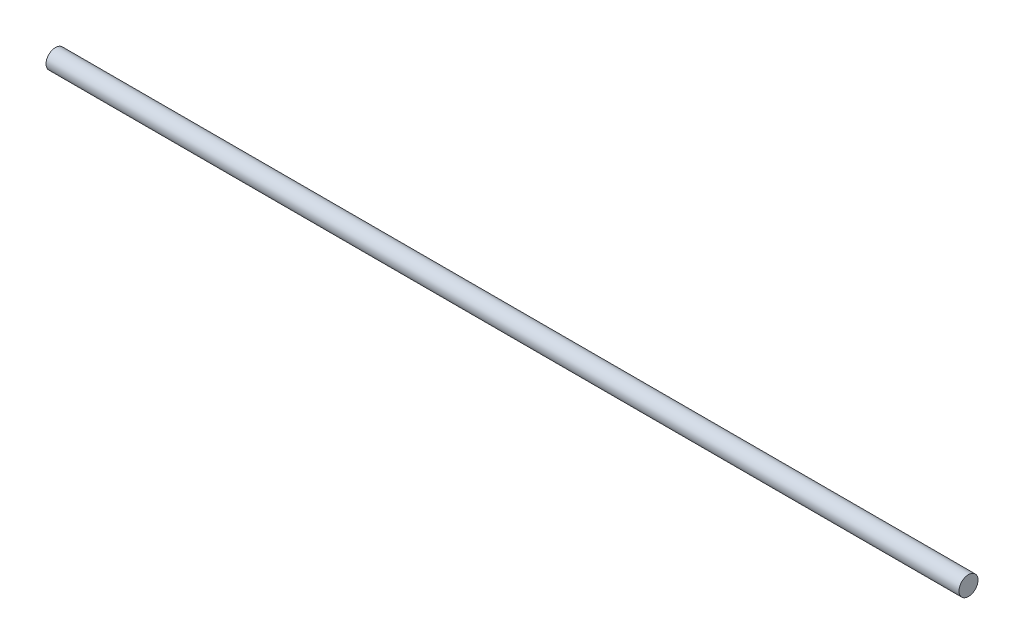
from build123d import *

# Parameters (mm, degrees)
SKETCH1_R           = 3.175
BOSS_EXTRUDE1_DEPTH = 304.8


with BuildPart() as part:
    # Sketch1 → Boss-Extrude1 (new body)
    with BuildSketch(Plane(origin=(0, 0, 0), x_dir=(0, 0, -1), z_dir=(1, 0, 0))):
        with Locations(Location((0, 0, 0), (0, 0, 180))):
            Circle(SKETCH1_R)
    extrude(amount=BOSS_EXTRUDE1_DEPTH)


solid = part.part
